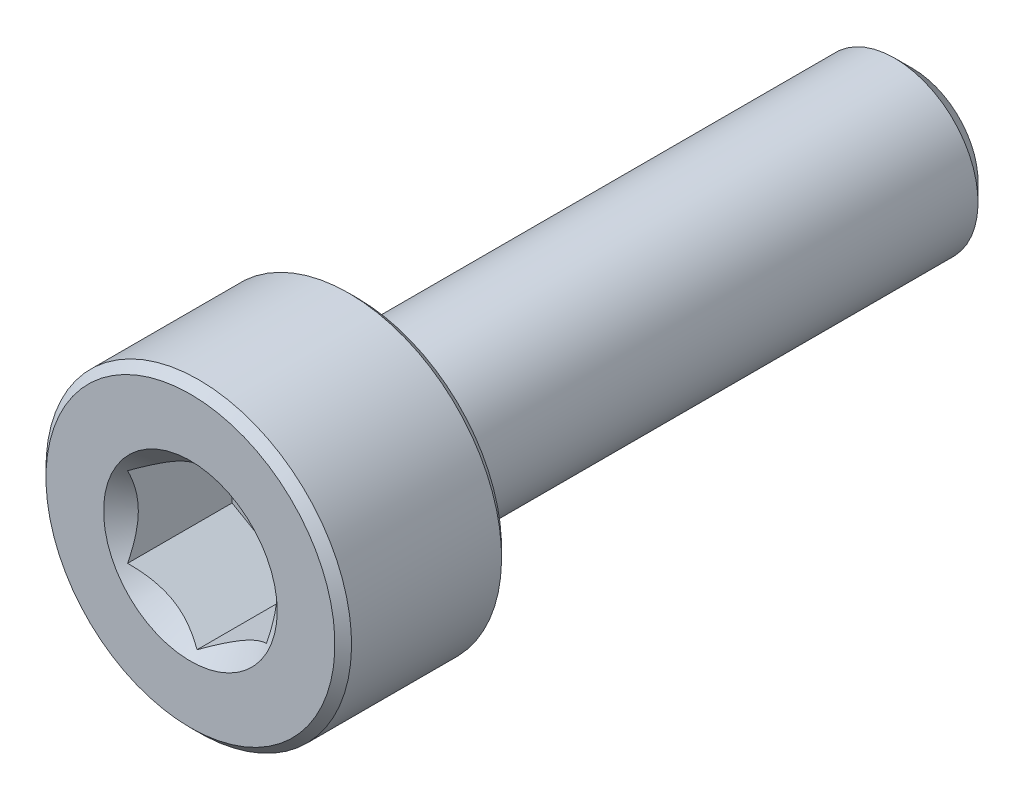
from build123d import *

# Parameters (mm, degrees)
CUT_EXTRUDE1_DEPTH = 2
SKETCH4_R          = 1.5625
CUT_EXTRUDE2_DEPTH = 1.5
CUT_EXTRUDE2_DRAFT = -45


with BuildPart() as part:
    # Sketch2 → Revolve1 (revolve)
    with BuildSketch(Plane(origin=(0, 0, 0), x_dir=(0, 0, -1), z_dir=(1, 0, 0))):
        with BuildLine():
            Line((-6.5, 0), (-6.5, 2.6))
            Line((-6.5, 2.6), (-6.35, 2.75))
            Line((-6.35, 2.75), (-3.65, 2.75))
            Line((-3.65, 2.75), (-3.5, 2.6))
            Line((-3.5, 2.6), (-3.5, 1.65))
            ThreePointArc((-3.5, 1.65), (-3.456066017, 1.543933983), (-3.35, 1.5))
            Line((-3.35, 1.5), (6.175240474, 1.5))
            Line((6.175240474, 1.5), (6.5, 1.175240474))
            Line((6.5, 1.175240474), (6.5, 0))
            Line((6.5, 0), (-6.5, 0))
        make_face()
    revolve(axis=Axis((0, 0, -6.5), (0, 0, 1)))

    # Sketch3 → Cut-Extrude1 (cut)
    with BuildSketch(Plane.XY.offset(6.5)):
        Polygon((1.25, -0.721687836), (1.25, 0.721687836), (0, 1.443375673), (-1.25, 0.721687836), (-1.25, -0.721687836), (0, -1.443375673), align=None)
    extrude(amount=-CUT_EXTRUDE1_DEPTH, mode=Mode.SUBTRACT)


with BuildPart() as cut_extrude2_tool:
    # Sketch4 → Cut-Extrude2 (with draft: the straight prism first)
    with BuildSketch(Plane.XY.offset(6.5)):
        Circle(SKETCH4_R)
    extrude(amount=-CUT_EXTRUDE2_DEPTH)
    # Cut-Extrude2: the draft: its side faces are tilted about the plane it starts from
    cut_extrude2_sides = [cut_extrude2_tool.faces().sort_by_distance(p)[0] for p in [
        (-1.5625, 0, 5.75),
    ]]
    draft(cut_extrude2_sides, Plane.XY.offset(6.5), CUT_EXTRUDE2_DRAFT)


with BuildPart() as part_1:
    add(part.part)

    # Cut-Extrude2: cut by cut_extrude2_tool
    add(cut_extrude2_tool.part, mode=Mode.SUBTRACT)


solid = part_1.part
